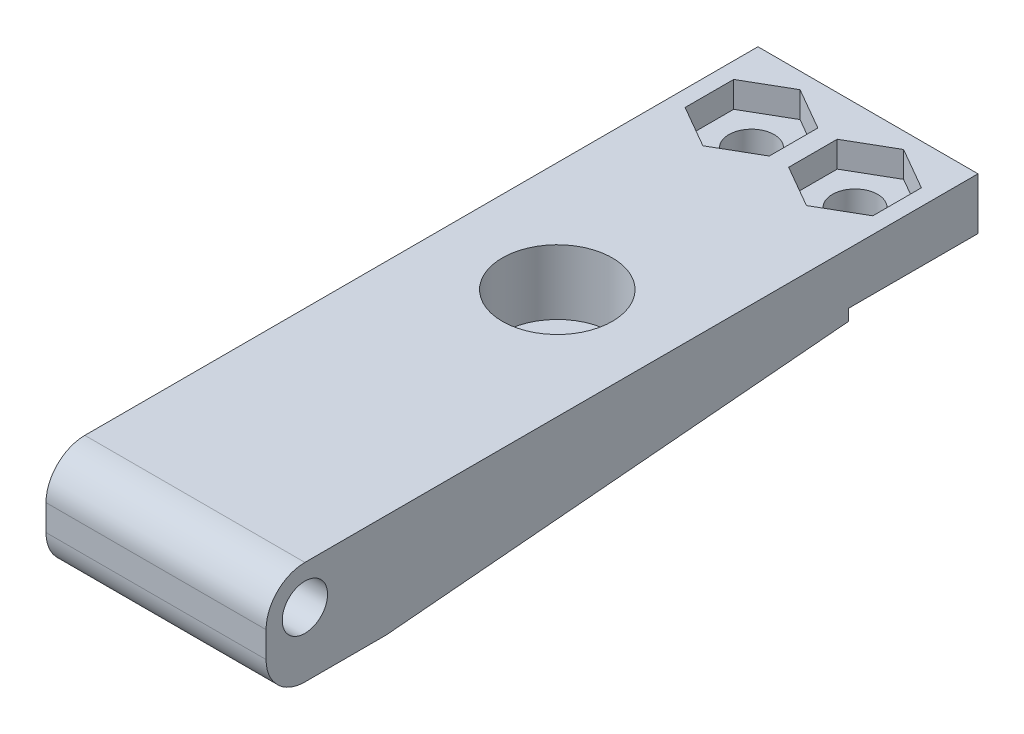
from build123d import *

# Parameters (mm, degrees)
SKETCH1_R           = 1.75
BOSS_EXTRUDE1_DEPTH = 8.5
FILLET1_R           = 3
SKETCH2_R           = 1.75
CUT_EXTRUDE1_DEPTH  = 54.293995909
SKETCH2_3_R         = 1.75
CUT_EXTRUDE2_DEPTH  = 2
SKETCH3_R           = 4.25
CUT_EXTRUDE3_DEPTH  = 5


with BuildPart() as part:
    # Sketch1 → Boss-Extrude1 (new, symmetric)
    with BuildSketch(Plane(origin=(0, 0, 0), x_dir=(0, 0, -1), z_dir=(1, 0, 0))):
        with BuildLine():
            ThreePointArc((0, 3), (-2.121320344, 2.121320344), (-3, 0))
            Line((-3, 0), (-3, -5))
            Line((-3, -5), (6.279790789, -5))
            Line((6.279790789, -5), (42, -1.874886635))
            Line((42, -1.874886635), (42, -1))
            Line((42, -1), (52, -1))
            Line((52, -1), (52, 3))
            Line((52, 3), (0, 3))
        make_face()
        Circle(SKETCH1_R, mode=Mode.SUBTRACT)
    extrude(amount=BOSS_EXTRUDE1_DEPTH, both=True)

    # Fillet1
    fillet1_edges = [part.edges().sort_by_distance(p)[0] for p in [
        (0, -5, 3),
    ]]
    fillet(fillet1_edges, radius=FILLET1_R)

    # Sketch2 → Cut-Extrude1 (cut, through all)
    with BuildSketch(Plane(origin=(0, 3, 0), x_dir=(1, 0, 0), z_dir=(0, 1, 0))):
        with Locations((-4, 47)):
            Circle(SKETCH2_R)
        with Locations((4, 47)):
            Circle(SKETCH2_R)
    extrude(amount=-CUT_EXTRUDE1_DEPTH, mode=Mode.SUBTRACT)

    # Sketch2<3> → Cut-Extrude2 (cut)
    # profile 1 of 2: a face of its own
    with BuildSketch(Plane(origin=(0, 3, 0), x_dir=(1, 0, 0), z_dir=(0, 1, 0))):
        Polygon((0.75, 48.876388375), (0.75, 45.123611625), (4, 43.24722325), (7.25, 45.123611625), (7.25, 48.876388375), (4, 50.75277675), align=None)
        with Locations((4, 47)):
            Circle(SKETCH2_3_R, mode=Mode.SUBTRACT)
    # profile 2 of 2: a face of its own
    with BuildSketch(Plane(origin=(0, 3, 0), x_dir=(1, 0, 0), z_dir=(0, 1, 0))):
        Polygon((-0.75, 45.123611625), (-0.75, 48.876388375), (-4, 50.75277675), (-7.25, 48.876388375), (-7.25, 45.123611625), (-4, 43.24722325), align=None)
        with Locations((-4, 47)):
            Circle(SKETCH2_3_R, mode=Mode.SUBTRACT)
    extrude(amount=-CUT_EXTRUDE2_DEPTH, mode=Mode.SUBTRACT)

    # Sketch3 → Cut-Extrude3 (cut)
    with BuildSketch(Plane(origin=(0, 3, 0), x_dir=(1, 0, 0), z_dir=(0, 1, 0))):
        with Locations((0, 28)):
            Circle(SKETCH3_R)
    extrude(amount=-CUT_EXTRUDE3_DEPTH, mode=Mode.SUBTRACT)


solid = part.part
